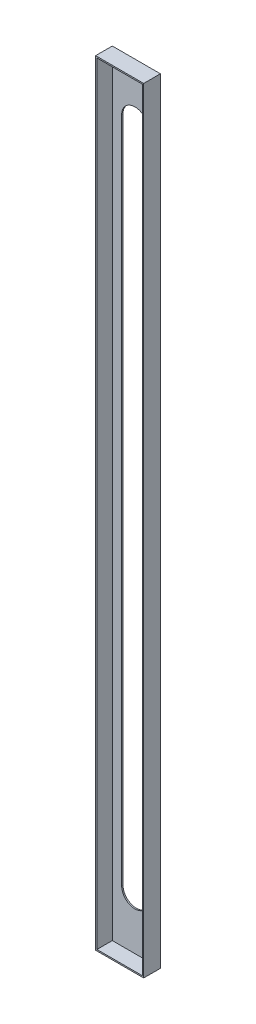
from build123d import *

# Parameters (mm, degrees)
SKETCH_1_W          = 7.2
SKETCH_1_H          = 116
EXTRUDE_1_DEPTH     = 2.5
SHELL_1_T           = -0.2
CUT_EXTRUDE_1_DEPTH = 2.5


with BuildPart() as part:
    # 스케치1 → 보스-돌출1 (new body)
    with BuildSketch(Plane.XY):
        with Locations((3.6, 58)):
            Rectangle(SKETCH_1_W, SKETCH_1_H)
    extrude(amount=EXTRUDE_1_DEPTH)

    # 쉘1
    shell_1_openings = [part.faces().sort_by_distance(p)[0] for p in [
        (3.6, 58, 2.5),
    ]]
    offset(amount=SHELL_1_T, openings=shell_1_openings, kind=Kind.INTERSECTION)

    # 스케치2 → 컷-돌출1 (cut)
    with BuildSketch(Plane.XY.offset(0.2)):
        with BuildLine():
            Line((5.6, 108), (5.6, 8))
            ThreePointArc((5.6, 8), (3.6, 6), (1.6, 8))
            Line((1.6, 8), (1.6, 108))
            ThreePointArc((1.6, 108), (3.6, 110), (5.6, 108))
        make_face()
    extrude(amount=-CUT_EXTRUDE_1_DEPTH, mode=Mode.SUBTRACT)


solid = part.part
